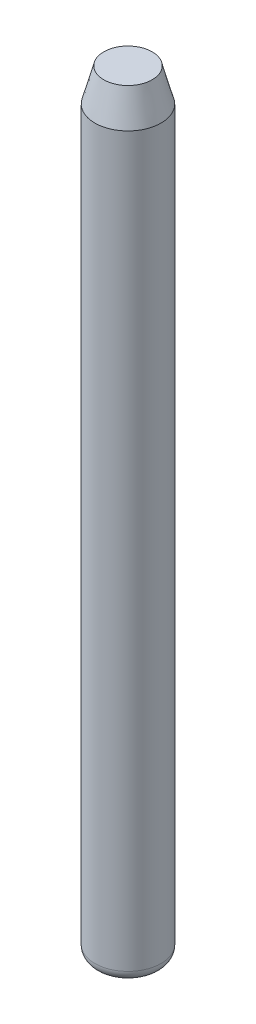
from build123d import *

# Parameters (mm, degrees)
SKETCH1_R           = 1.5
BOSS_EXTRUDE1_DEPTH = 35
CHAMFER1_SIZE       = 1.5
CHAMFER1_SIZE2      = 0.401923789
FILLET1_R           = 0.5


with BuildPart() as part:
    # Sketch1 → Boss-Extrude1 (new body)
    with BuildSketch(Plane(origin=(0, 0, 0), x_dir=(1, 0, 0), z_dir=(0, 1, 0))):
        with Locations(Location((0, 0, 0), (0, 0, 270))):
            Circle(SKETCH1_R)
    extrude(amount=BOSS_EXTRUDE1_DEPTH)

    # Chamfer1
    chamfer1_edges = [part.edges().sort_by_distance(p)[0] for p in [
        (0, 35, -1.5),
    ]]
    chamfer1_side = [part.faces().sort_by_distance(p)[0] for p in [
        (0, 17.5, -1.5),
    ]]
    chamfer(chamfer1_edges, length=CHAMFER1_SIZE, length2=CHAMFER1_SIZE2, reference=chamfer1_side[0])

    # Fillet1
    fillet1_edges = [part.edges().sort_by_distance(p)[0] for p in [
        (0, 0, -1.5),
    ]]
    fillet(fillet1_edges, radius=FILLET1_R)


solid = part.part
